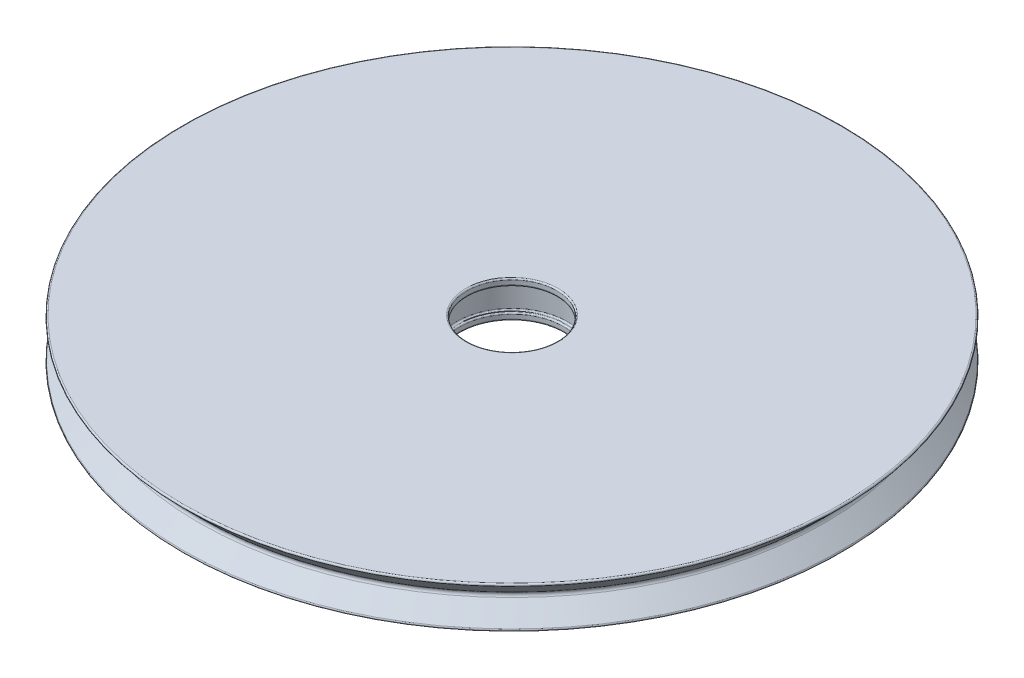
from build123d import *

# Parameters (mm, degrees)
CONG_1_R                     = 0.2
CONG_2_R                     = 0.5
R_P_TITION_CIRCULAIRE1_COUNT = 3


with BuildPart() as part:
    # Esquisse1 → Révolution1 (revolve)
    with BuildSketch(Plane.XY, mode=Mode.PRIVATE) as r_volution1_sk:
        Polygon((6.5, 3), (48, 3), (45, 0), (48, -3), (7.5, -3), (7.5, -2), (8, -2), (8, 2), (6.5, 2), align=None)
    revolve(r_volution1_sk.sketch.rotate(Axis((0, 3, 0), (0, -1, 0)), 90), axis=Axis((0, 3, 0), (0, -1, 0)))

    # Congé1
    cong_1_edges = [part.edges().sort_by_distance(p)[0] for p in [
        (0, 2, -6.5),
        (0, 3, -6.5),
        (0, 3, -48),
        (0, -3, -48),
        (0, -3, -7.5),
        (0, -2, -7.5),
        (0, -2, -8),
        (0, 2, -8),
    ]]
    fillet(cong_1_edges, radius=CONG_1_R)

    # Congé2
    cong_2_edges = [part.edges().sort_by_distance(p)[0] for p in [
        (0, 0, -45),
    ]]
    fillet(cong_2_edges, radius=CONG_2_R)

    # Esquisse2 → Enlèvement de matière-Révolution1 (revolve, cut)
    with BuildSketch(Plane.XY, mode=Mode.PRIVATE) as enl_vement_de_mati_re_r_volution1_sk:
        Polygon((40, 2.8), (41.5, 2.8), (41.5, 0.3), (43, 0.3), (43, -3), (40, -3), align=None)
    enl_vement_de_mati_re_r_volution1 = revolve(enl_vement_de_mati_re_r_volution1_sk.sketch.rotate(Axis((40, 2.8, 0), (0, 1, 0)), 90), axis=Axis((40, 2.8, 0), (0, 1, 0)), mode=Mode.SUBTRACT)

    # Répétition circulaire1: Enlèvement de matière-Révolution1 ×3 about axis
    r_p_tition_circulaire1_axis = Axis((0, 0, 0), (0, 1, 0))
    for i in range(1, R_P_TITION_CIRCULAIRE1_COUNT):
        add(enl_vement_de_mati_re_r_volution1.rotate(r_p_tition_circulaire1_axis, i * 360 / R_P_TITION_CIRCULAIRE1_COUNT), mode=Mode.SUBTRACT)

    # Esquisse3 → Enlèvement de matière-Révolution2 (revolve, cut)
    with BuildSketch(Plane.XY, mode=Mode.PRIVATE) as enl_vement_de_mati_re_r_volution2_sk:
        with BuildLine():
            Line((10, -3), (43.757359313, -3))
            Line((43.757359313, -3), (41.043145751, -0.285786438))
            ThreePointArc((41.043145751, -0.285786438), (40.394299053, 0.147759065), (39.628932188, 0.3))
            Line((39.628932188, 0.3), (12, 0.3))
            ThreePointArc((12, 0.3), (10.585786438, -0.285786438), (10, -1.7))
            Line((10, -1.7), (10, -3))
        make_face()
    revolve(enl_vement_de_mati_re_r_volution2_sk.sketch.rotate(Axis((0, -3, 0), (0, 1, 0)), 90), axis=Axis((0, -3, 0), (0, 1, 0)), mode=Mode.SUBTRACT)


solid = part.part
